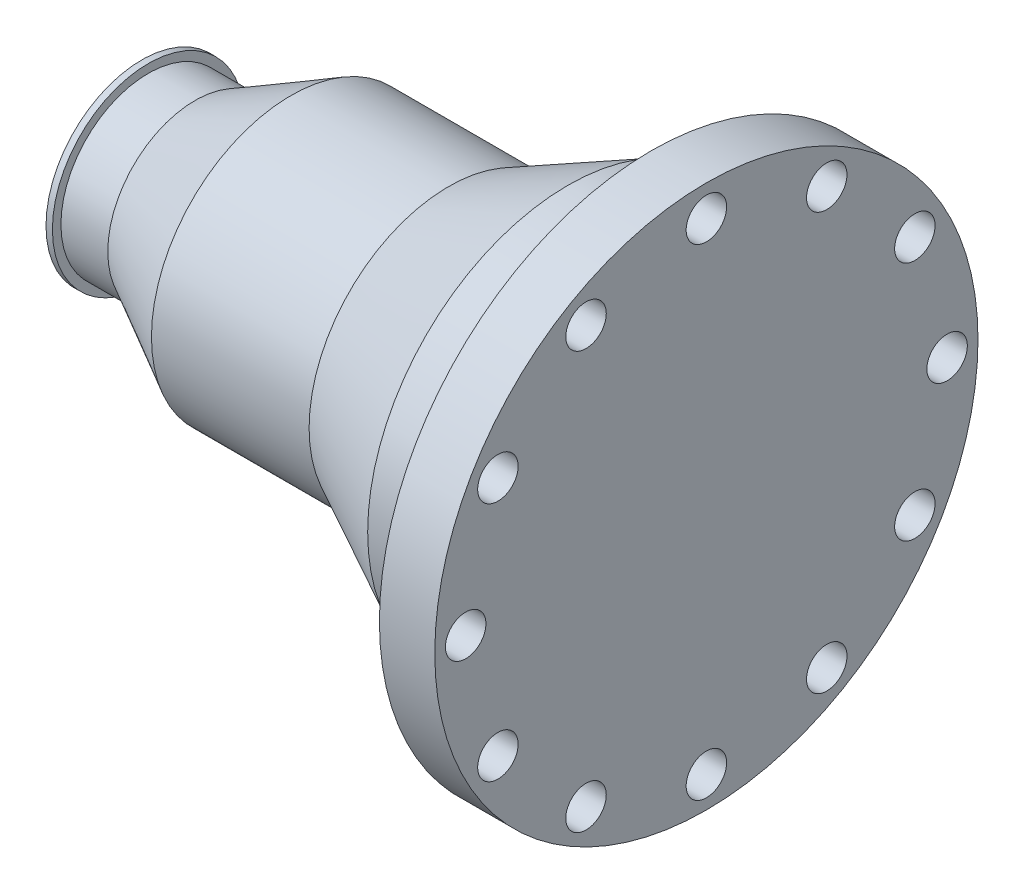
from build123d import *

# Parameters (mm, degrees)
SKETCH_2_W           = 38
SKETCH_2_H           = 31
SKETCH_3_R           = 9.5
CUT_EXTRUDE_1_DEPTH  = 321.526909947
SKETCH_4_R           = 9.5
CUT_EXTRUDE_2_DEPTH  = 321.526909947
SKETCH_5_R           = 9.5
CUT_EXTRUDE_3_DEPTH  = 321.526909947
SKETCH_6_R           = 9.5
CUT_EXTRUDE_4_DEPTH  = 321.526909947
SKETCH_7_R           = 9.5
CUT_EXTRUDE_5_DEPTH  = 321.526909947
SKETCH_8_R           = 9.5
CUT_EXTRUDE_6_DEPTH  = 321.526909947
SKETCH_9_R           = 9.5
CUT_EXTRUDE_7_DEPTH  = 321.526909947
SKETCH_10_R          = 9.5
CUT_EXTRUDE_8_DEPTH  = 321.526909947
SKETCH_11_R          = 9.5
CUT_EXTRUDE_9_DEPTH  = 321.526909947
SKETCH_12_R          = 9.5
CUT_EXTRUDE_10_DEPTH = 321.526909947
SKETCH_13_R          = 9.5
CUT_EXTRUDE_11_DEPTH = 321.526909947
SKETCH_14_R          = 9.5
CUT_EXTRUDE_12_DEPTH = 321.526909947


with BuildPart() as part:
    # Эскиз1 → Повернуть1 (revolve)
    with BuildSketch(Plane.XY, mode=Mode.PRIVATE) as revolve_1_sk:
        Polygon((0, 0), (265, 0), (265, 127.5), (239, 127.5), (239, 100), (239, 95), (220, 95), (220, 94), (200, 94), (144, 65.5), (70, 65.5), (25, 41), (3, 41), (3, 45), (0, 45), align=None)
    revolve(revolve_1_sk.sketch.rotate(Axis((0, 0, 0), (1, 0, 0)), 90), axis=Axis((0, 0, 0), (1, 0, 0)))

    # Эскиз2 → Вырез-Повернуть1 (revolve, cut)
    with BuildSketch(Plane.XY, mode=Mode.PRIVATE) as cut_revolve_1_sk:
        with Locations((19, 15.5)):
            Rectangle(SKETCH_2_W, SKETCH_2_H)
    revolve(cut_revolve_1_sk.sketch.rotate(Axis((0, 0, 0), (1, 0, 0)), 90), axis=Axis((0, 0, 0), (1, 0, 0)), mode=Mode.SUBTRACT)

    # Эскиз3 → Вырез-Вытянуть1 (cut, through all)
    with BuildSketch(Plane(origin=(0, 0, 0), x_dir=(0, 0, -1), z_dir=(1, 0, 0))):
        with Locations((0, 113)):
            Circle(SKETCH_3_R)
    extrude(amount=CUT_EXTRUDE_1_DEPTH, mode=Mode.SUBTRACT)

    # Эскиз4 → Вырез-Вытянуть2 (cut, through all)
    with BuildSketch(Plane(origin=(0, 0, 0), x_dir=(0, 0, -1), z_dir=(1, 0, 0))):
        with Locations((-56.5, 97.860870628)):
            Circle(SKETCH_4_R)
    extrude(amount=CUT_EXTRUDE_2_DEPTH, mode=Mode.SUBTRACT)

    # Эскиз5 → Вырез-Вытянуть3 (cut, through all)
    with BuildSketch(Plane(origin=(0, 0, 0), x_dir=(0, 0, -1), z_dir=(1, 0, 0))):
        with Locations((-97.860870628, 56.5)):
            Circle(SKETCH_5_R)
    extrude(amount=CUT_EXTRUDE_3_DEPTH, mode=Mode.SUBTRACT)

    # Эскиз6 → Вырез-Вытянуть4 (cut, through all)
    with BuildSketch(Plane(origin=(0, 0, 0), x_dir=(0, 0, -1), z_dir=(1, 0, 0))):
        with Locations((-113, 0)):
            Circle(SKETCH_6_R)
    extrude(amount=CUT_EXTRUDE_4_DEPTH, mode=Mode.SUBTRACT)

    # Эскиз7 → Вырез-Вытянуть5 (cut, through all)
    with BuildSketch(Plane(origin=(0, 0, 0), x_dir=(0, 0, -1), z_dir=(1, 0, 0))):
        with Locations((-97.860870628, -56.5)):
            Circle(SKETCH_7_R)
    extrude(amount=CUT_EXTRUDE_5_DEPTH, mode=Mode.SUBTRACT)

    # Эскиз8 → Вырез-Вытянуть6 (cut, through all)
    with BuildSketch(Plane(origin=(0, 0, 0), x_dir=(0, 0, -1), z_dir=(1, 0, 0))):
        with Locations((-56.5, -97.860870628)):
            Circle(SKETCH_8_R)
    extrude(amount=CUT_EXTRUDE_6_DEPTH, mode=Mode.SUBTRACT)

    # Эскиз9 → Вырез-Вытянуть7 (cut, through all)
    with BuildSketch(Plane(origin=(0, 0, 0), x_dir=(0, 0, -1), z_dir=(1, 0, 0))):
        with Locations((0, -113)):
            Circle(SKETCH_9_R)
    extrude(amount=CUT_EXTRUDE_7_DEPTH, mode=Mode.SUBTRACT)

    # Эскиз10 → Вырез-Вытянуть8 (cut, through all)
    with BuildSketch(Plane(origin=(0, 0, 0), x_dir=(0, 0, -1), z_dir=(1, 0, 0))):
        with Locations((56.5, -97.860870628)):
            Circle(SKETCH_10_R)
    extrude(amount=CUT_EXTRUDE_8_DEPTH, mode=Mode.SUBTRACT)

    # Эскиз11 → Вырез-Вытянуть9 (cut, through all)
    with BuildSketch(Plane(origin=(0, 0, 0), x_dir=(0, 0, -1), z_dir=(1, 0, 0))):
        with Locations((97.860870628, -56.5)):
            Circle(SKETCH_11_R)
    extrude(amount=CUT_EXTRUDE_9_DEPTH, mode=Mode.SUBTRACT)

    # Эскиз12 → Вырез-Вытянуть10 (cut, through all)
    with BuildSketch(Plane(origin=(0, 0, 0), x_dir=(0, 0, -1), z_dir=(1, 0, 0))):
        with Locations((113, 0)):
            Circle(SKETCH_12_R)
    extrude(amount=CUT_EXTRUDE_10_DEPTH, mode=Mode.SUBTRACT)

    # Эскиз13 → Вырез-Вытянуть11 (cut, through all)
    with BuildSketch(Plane(origin=(0, 0, 0), x_dir=(0, 0, -1), z_dir=(1, 0, 0))):
        with Locations((97.860870628, 56.5)):
            Circle(SKETCH_13_R)
    extrude(amount=CUT_EXTRUDE_11_DEPTH, mode=Mode.SUBTRACT)

    # Эскиз14 → Вырез-Вытянуть12 (cut, through all)
    with BuildSketch(Plane(origin=(0, 0, 0), x_dir=(0, 0, -1), z_dir=(1, 0, 0))):
        with Locations((56.5, 97.860870628)):
            Circle(SKETCH_14_R)
    extrude(amount=CUT_EXTRUDE_12_DEPTH, mode=Mode.SUBTRACT)


solid = part.part
